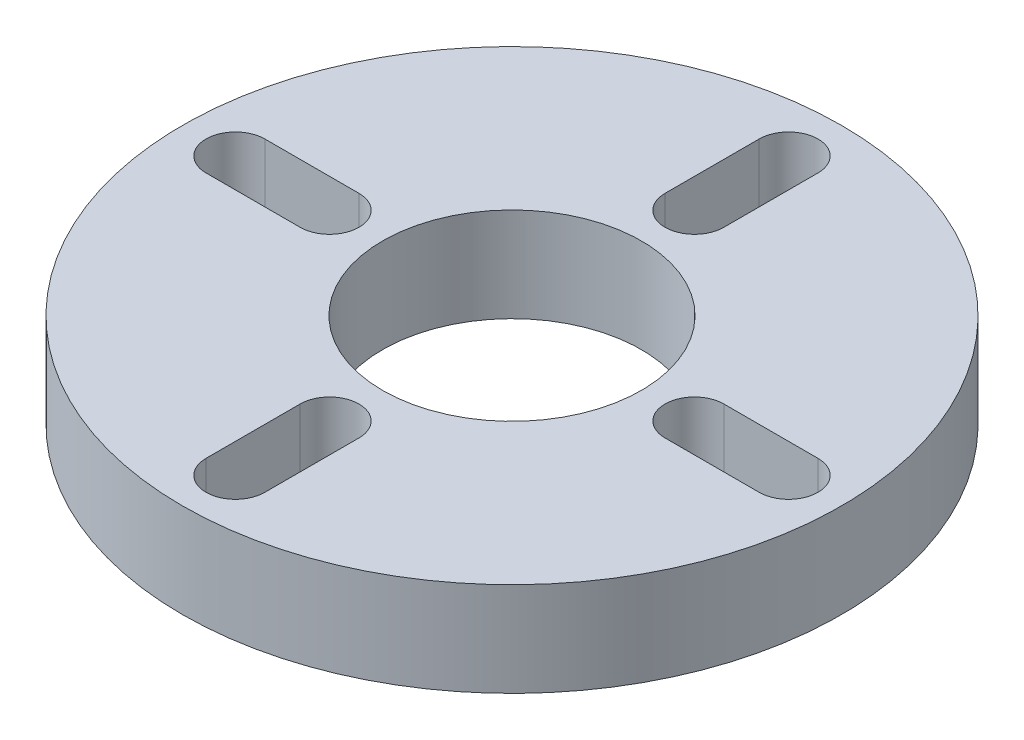
from build123d import *

# Parameters (mm, degrees)
SKETCH1_R           = 14
BOSS_EXTRUDE1_DEPTH = 4
SKETCH2_R           = 5.5
CUT_EXTRUDE1_DEPTH  = 21.199009877
CUT_EXTRUDE3_DEPTH  = 21.199009877


with BuildPart() as part:
    # Sketch1 → Boss-Extrude1 (new body)
    with BuildSketch(Plane(origin=(0, 0, 0), x_dir=(1, 0, 0), z_dir=(0, 1, 0))):
        with Locations(Location((0, 0, 0), (0, 0, 270))):
            Circle(SKETCH1_R)
    extrude(amount=BOSS_EXTRUDE1_DEPTH)

    # Sketch2 → Cut-Extrude1 (cut, through all)
    with BuildSketch(Plane(origin=(0, 4, 0), x_dir=(1, 0, 0), z_dir=(0, 1, 0))):
        with Locations(Location((0, 0, 0), (0, 0, 270))):
            Circle(SKETCH2_R)
    extrude(amount=-CUT_EXTRUDE1_DEPTH, mode=Mode.SUBTRACT)

    # Sketch3 → Cut-Extrude3 (cut, through all)
    with BuildSketch(Plane(origin=(0, 4, 0), x_dir=(1, 0, 0), z_dir=(0, 1, 0))):
        with BuildLine():
            Line((-11.75, 1.25), (-7.75, 1.25))
            ThreePointArc((-7.75, 1.25), (-6.5, 0), (-7.75, -1.25))
            Line((-7.75, -1.25), (-11.75, -1.25))
            ThreePointArc((-11.75, -1.25), (-13, 0), (-11.75, 1.25))
        make_face()
        with BuildLine():
            Line((-1.25, 11.75), (-1.25, 7.75))
            ThreePointArc((-1.25, 7.75), (0, 6.5), (1.25, 7.75))
            Line((1.25, 7.75), (1.25, 11.75))
            ThreePointArc((1.25, 11.75), (0, 13), (-1.25, 11.75))
        make_face()
        with BuildLine():
            Line((11.75, 1.25), (7.75, 1.25))
            ThreePointArc((7.75, 1.25), (6.5, 0), (7.75, -1.25))
            Line((7.75, -1.25), (11.75, -1.25))
            ThreePointArc((11.75, -1.25), (13, 0), (11.75, 1.25))
        make_face()
        with BuildLine():
            Line((1.25, -11.75), (1.25, -7.75))
            ThreePointArc((1.25, -7.75), (0, -6.5), (-1.25, -7.75))
            Line((-1.25, -7.75), (-1.25, -11.75))
            ThreePointArc((-1.25, -11.75), (0, -13), (1.25, -11.75))
        make_face()
    extrude(amount=-CUT_EXTRUDE3_DEPTH, mode=Mode.SUBTRACT)


solid = part.part
